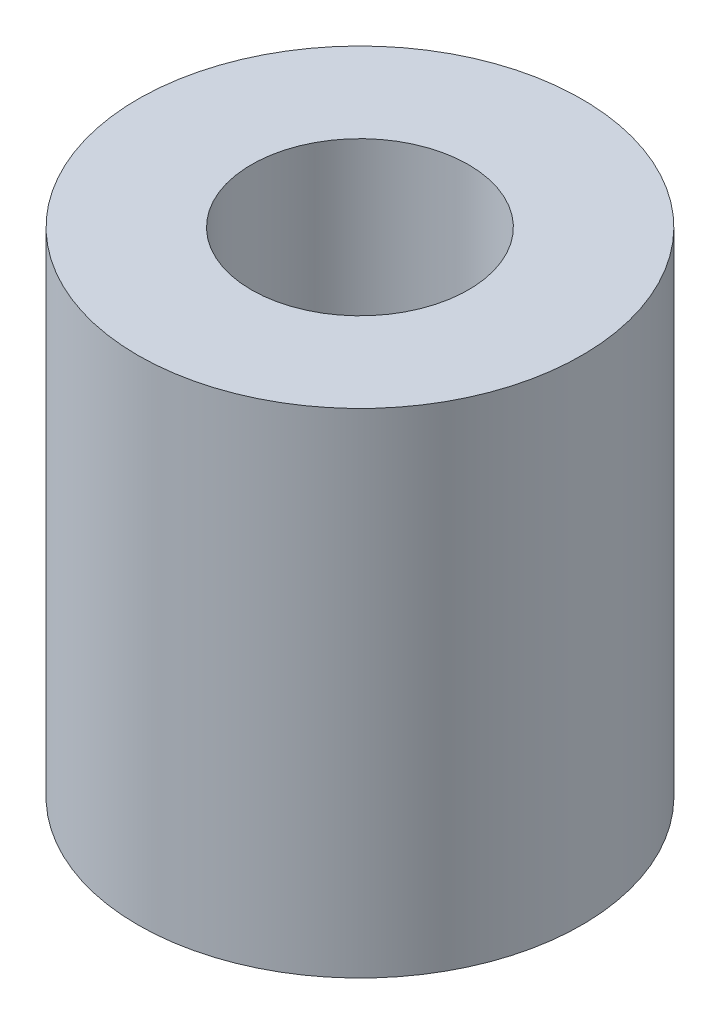
from build123d import *

# Parameters (mm, degrees)
SKETCH1_R           = 2.25
SKETCH1_R_2         = 1.1
BOSS_EXTRUDE1_DEPTH = 5


with BuildPart() as part:
    # Sketch1 → Boss-Extrude1 (new body)
    with BuildSketch(Plane(origin=(0, 0, 0), x_dir=(1, 0, 0), z_dir=(0, 1, 0))):
        with Locations(Location((0, 0, 0), (0, 0, 270))):
            Circle(SKETCH1_R)
        with Locations(Location((0, 0, 0), (0, 0, 270))):
            Circle(SKETCH1_R_2, mode=Mode.SUBTRACT)
    extrude(amount=BOSS_EXTRUDE1_DEPTH)


solid = part.part
